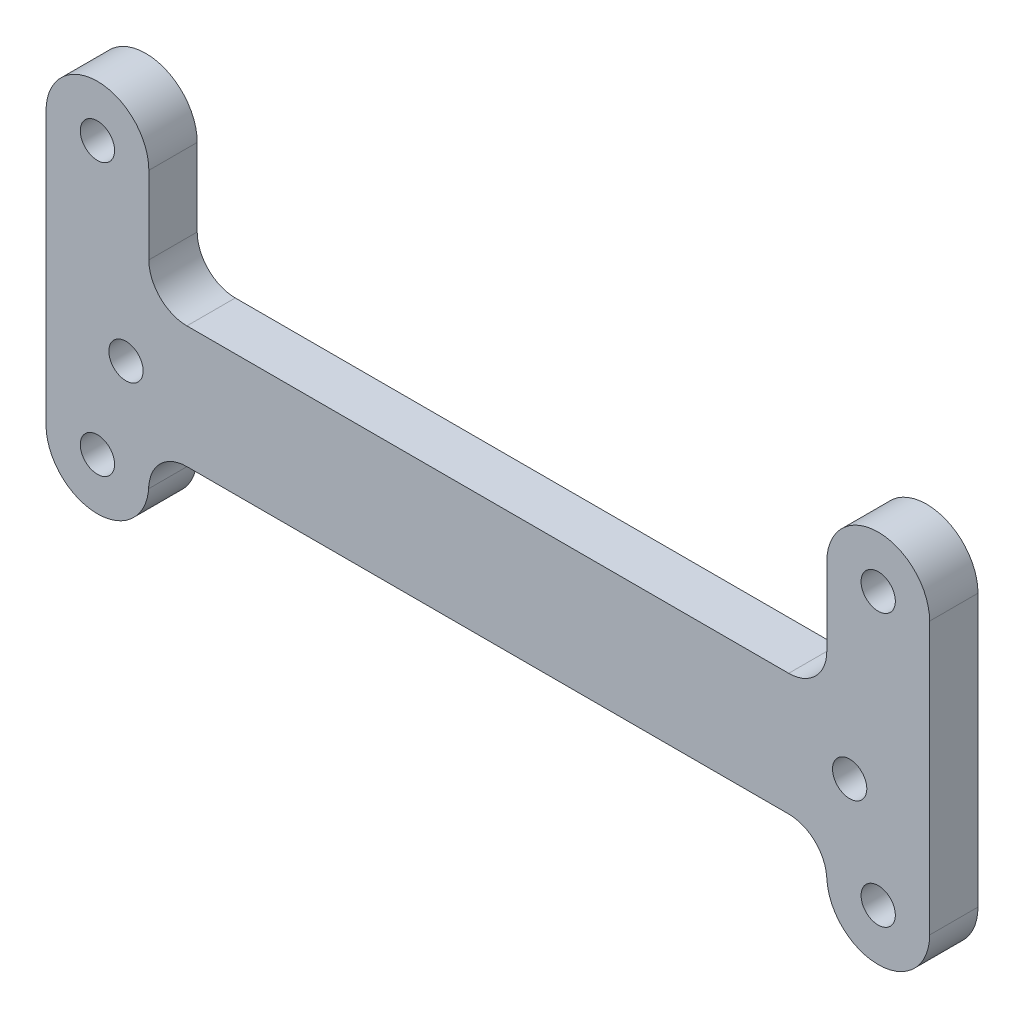
from build123d import *

# Parameters (mm, degrees)
SKETCH2_R           = 2.25
BOSS_EXTRUDE1_DEPTH = 6.35


with BuildPart() as part:
    # Sketch2 → Boss-Extrude1 (new body)
    with BuildSketch(Plane(origin=(0, 0, 71.255), x_dir=(-1, 0, 0), z_dir=(0, 0, -1))):
        with BuildLine():
            Line((-39.5, -8), (39.5, -8))
            ThreePointArc((39.5, -8), (43.035533906, -9.464466094), (44.5, -13))
            Line((44.5, -13), (44.5, -12.496398734))
            ThreePointArc((44.5, -12.496398734), (51.25, -19.246398734), (58, -12.496398734))
            Line((58, -12.496398734), (58, 23.184046239))
            ThreePointArc((58, 23.184046239), (51.25, 29.934046239), (44.5, 23.184046239))
            Line((44.5, 23.184046239), (44.5, 13))
            ThreePointArc((44.5, 13), (43.035533906, 9.464466094), (39.5, 8))
            Line((39.5, 8), (-39.5, 8))
            ThreePointArc((-39.5, 8), (-43.035533906, 9.464466094), (-44.5, 13))
            Line((-44.5, 13), (-44.5, 23.184046239))
            ThreePointArc((-44.5, 23.184046239), (-51.25, 29.934046239), (-58, 23.184046239))
            Line((-58, 23.184046239), (-58, -12.496398734))
            ThreePointArc((-58, -12.496398734), (-51.539037503, -19.240207548), (-44.524753386, -13.073943522))
            Line((-44.524753386, -13.073943522), (-44.481664158, -12.572189046))
            ThreePointArc((-44.481664158, -12.572189046), (-42.880898196, -9.316316058), (-39.5, -8))
        make_face()
        with Locations((47.5, 0)):
            Circle(SKETCH2_R, mode=Mode.SUBTRACT)
        with Locations((-47.5, 0)):
            Circle(SKETCH2_R, mode=Mode.SUBTRACT)
        with Locations((51.25, 23.184046239)):
            Circle(SKETCH2_R, mode=Mode.SUBTRACT)
        with Locations((51.25, -12.496398734)):
            Circle(SKETCH2_R, mode=Mode.SUBTRACT)
        with Locations((-51.25, -12.496398734)):
            Circle(SKETCH2_R, mode=Mode.SUBTRACT)
        with Locations((-51.25, 23.184046239)):
            Circle(SKETCH2_R, mode=Mode.SUBTRACT)
    extrude(amount=BOSS_EXTRUDE1_DEPTH)


solid = part.part
